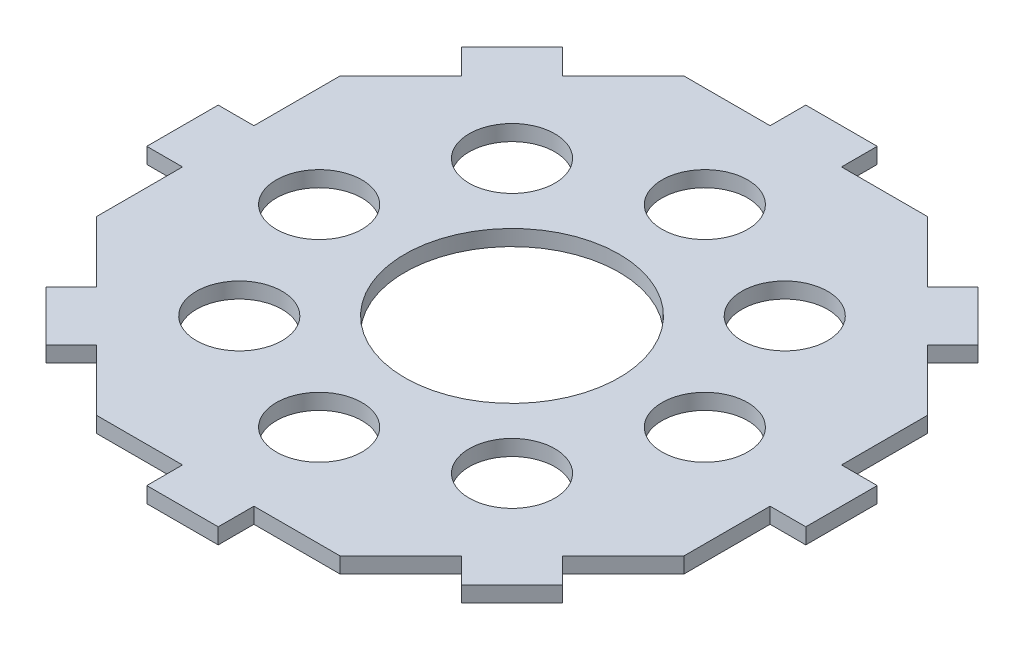
from build123d import *

# Parameters (mm, degrees)
SKETCH1_R           = 6
SKETCH1_R_2         = 15
BOSS_EXTRUDE1_DEPTH = 2.2


with BuildPart() as part:
    # Sketch1 → Boss-Extrude1 (new body)
    with BuildSketch(Plane(origin=(0, 0, 0), x_dir=(1, 0, 0), z_dir=(0, 1, 0))):
        Polygon((-55.857081241, 81.871122291), (-55.857081241, 86.871122291), (-65.857081241, 86.871122291), (-65.857081241, 81.871122291), (-77.894941, 81.871122291), (-86.406993267, 73.359070024), (-89.942527173, 76.89460393), (-97.013594985, 69.823536118), (-93.478061079, 66.288002212), (-101.990113346, 57.775949945), (-101.990113346, 45.738090186), (-106.990113346, 45.738090186), (-106.990113346, 35.738090186), (-101.990113346, 35.738090186), (-101.990113346, 23.700230426), (-93.478061079, 15.188178159), (-97.013594985, 11.652644253), (-89.942527173, 4.581576441), (-86.406993267, 8.117110347), (-77.894941, -0.39494192), (-65.857081241, -0.39494192), (-65.857081241, -5.39494192), (-55.857081241, -5.39494192), (-55.857081241, -0.39494192), (-43.819221481, -0.39494192), (-35.307169214, 8.117110347), (-31.771635308, 4.581576441), (-24.700567496, 11.652644253), (-28.236101402, 15.188178159), (-19.724049135, 23.700230426), (-19.724049135, 35.738090186), (-14.724049135, 35.738090186), (-14.724049135, 45.738090186), (-19.724049135, 45.738090186), (-19.724049135, 57.775949945), (-28.236101402, 66.288002212), (-24.700567496, 69.823536118), (-31.771635308, 76.89460393), (-35.307169214, 73.359070024), (-43.819221481, 81.871122291), align=None)
        with Locations(Location((-60.857081241, 67.738090186, 0), (0, 0, 270))):
            Circle(SKETCH1_R, mode=Mode.SUBTRACT)
        with Locations(Location((-41.765198148, 59.829973278, 0), (0, 0, 270))):
            Circle(SKETCH1_R, mode=Mode.SUBTRACT)
        with Locations(Location((-33.857081241, 40.738090186, 0), (0, 0, 270))):
            Circle(SKETCH1_R, mode=Mode.SUBTRACT)
        with Locations(Location((-41.765198148, 21.646207094, 0), (0, 0, 270))):
            Circle(SKETCH1_R, mode=Mode.SUBTRACT)
        with Locations(Location((-60.857081241, 13.738090186, 0), (0, 0, 270))):
            Circle(SKETCH1_R, mode=Mode.SUBTRACT)
        with Locations(Location((-79.948964333, 21.646207094, 0), (0, 0, 270))):
            Circle(SKETCH1_R, mode=Mode.SUBTRACT)
        with Locations(Location((-87.857081241, 40.738090186, 0), (0, 0, 270))):
            Circle(SKETCH1_R, mode=Mode.SUBTRACT)
        with Locations(Location((-79.948964333, 59.829973278, 0), (0, 0, 270))):
            Circle(SKETCH1_R, mode=Mode.SUBTRACT)
        with Locations(Location((-60.857081241, 40.738090186, 0), (0, 0, 270))):
            Circle(SKETCH1_R_2, mode=Mode.SUBTRACT)
    extrude(amount=BOSS_EXTRUDE1_DEPTH)


solid = part.part
